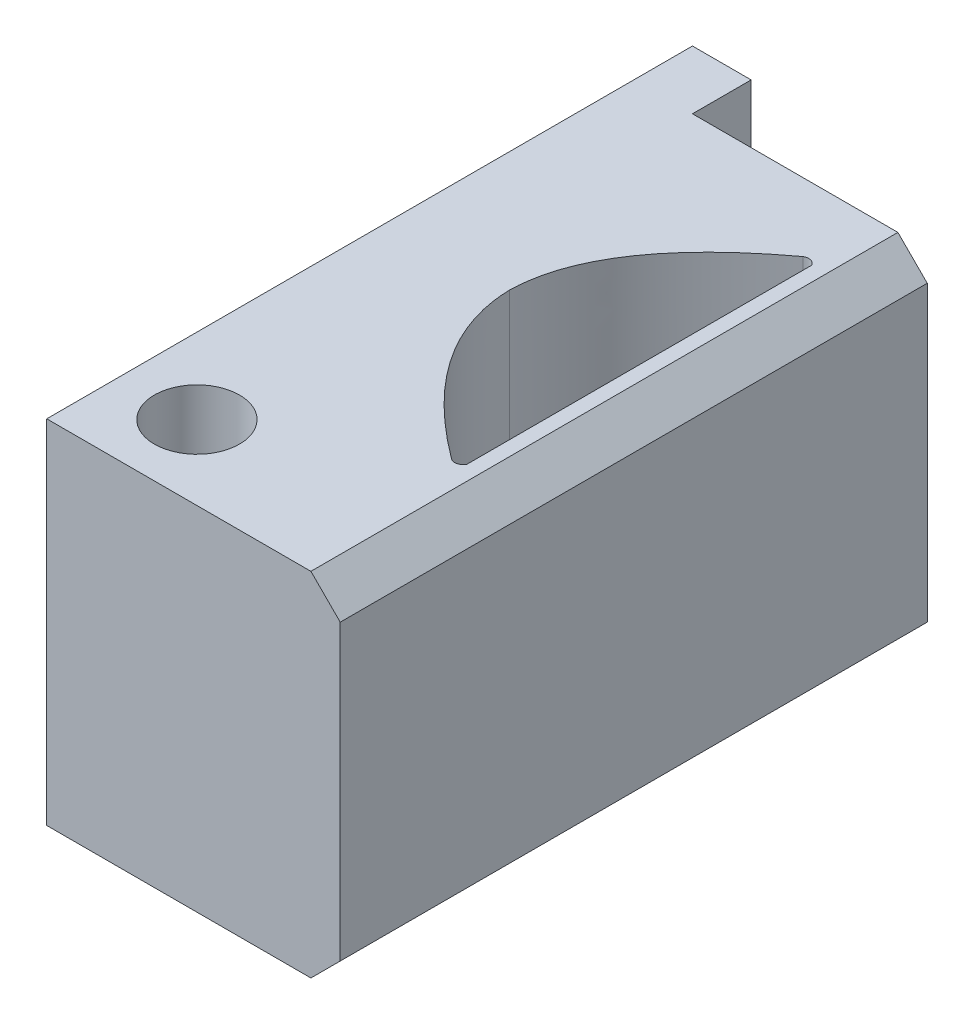
from build123d import *

# Parameters (mm, degrees)
SKETCH2_W           = 10
SKETCH2_H           = 20
BOSS_EXTRUDE1_DEPTH = 12
SKETCH4_R           = 1.45
CUT_EXTRUDE1_DEPTH  = 22
SKETCH5_R           = 0.201375714
CUT_EXTRUDE2_DEPTH  = 34
SKETCH6_R           = 4
CUT_EXTRUDE3_DEPTH  = 2
SKETCH7_W           = 2
SKETCH7_H           = 12
BOSS_EXTRUDE4_DEPTH = 2
CHAMFER1_SIZE       = 1


with BuildPart() as part:
    # Sketch2 → Boss-Extrude1 (new body)
    with BuildSketch(Plane(origin=(0, 0, 0), x_dir=(1, 0, 0), z_dir=(0, 1, 0))):
        with Locations((-9.742268041, 1.958762887)):
            Rectangle(SKETCH2_W, SKETCH2_H)
    extrude(amount=BOSS_EXTRUDE1_DEPTH)

    # Sketch4 → Cut-Extrude1 (cut)
    with BuildSketch(Plane(origin=(0, 12, 0), x_dir=(1, 0, 0), z_dir=(0, 1, 0))):
        with Locations(Location((-12.161364559, -5.505377828, 0), (0, 0, 270))):
            Circle(SKETCH4_R)
    extrude(amount=-CUT_EXTRUDE1_DEPTH, mode=Mode.SUBTRACT)

    # Sketch5 → Cut-Extrude2 (cut)
    # profile 1 of 2: a face of its own
    with BuildSketch(Plane.XZ):
        with BuildLine():
            Line((-6.242268041, -9.519810645), (-6.242268041, 2.231313467))
            ThreePointArc((-6.242268041, 2.231313467), (-6.418660257, 2.371807213), (-6.642496519, 2.344420462))
            add(Edge.make_bspline(
                [(-6.642496519, 2.344420462), (-6.66140925, 2.33038701), (-6.68025518, 2.316351489), (-6.699034308, 2.302313899)],
                knots=[0.023195247, 0.023195247, 0.023195247, 0.023195247, 0.026563492, 0.026563492, 0.026563492, 0.026563492], degree=3))
            add(Edge.make_bspline(
                [(-6.699034308, 2.302313899), (-9.211405567, 0.424290628), (-10.573371912, -1.556580292), (-10.656105812, -3.577082439), (-10.65744251, -3.644248589)],
                knots=[0.026563492, 0.026563492, 0.026563492, 0.026563492, 0.477185204, 0.492669554, 0.492669554, 0.492669554, 0.492669554], degree=3))
            add(Edge.make_bspline(
                [(-6.699034308, -9.590811077), (-9.211405567, -7.712787806), (-10.573371912, -5.731916886), (-10.656105812, -3.711414739), (-10.65744251, -3.644248589)],
                knots=[0.026563492, 0.026563492, 0.026563492, 0.026563492, 0.477185204, 0.492669554, 0.492669554, 0.492669554, 0.492669554], degree=3))
            add(Edge.make_bspline(
                [(-6.642496519, -9.63291764), (-6.66140925, -9.618884188), (-6.68025518, -9.604848667), (-6.699034308, -9.590811077)],
                knots=[0.023195247, 0.023195247, 0.023195247, 0.023195247, 0.026563492, 0.026563492, 0.026563492, 0.026563492], degree=3))
            ThreePointArc((-6.642496519, -9.63291764), (-6.418660257, -9.660304391), (-6.242268041, -9.519810645))
        make_face()
        with Locations((-7.81457768, -3.845615826)):
            Circle(SKETCH5_R, mode=Mode.SUBTRACT)
    # profile 2 of 2: a face of its own
    with BuildSketch(Plane.XZ):
        with Locations((-7.81457768, -3.845615826)):
            Circle(SKETCH5_R)
    extrude(amount=-CUT_EXTRUDE2_DEPTH, mode=Mode.SUBTRACT)

    # Sketch6 → Cut-Extrude3 (cut)
    with BuildSketch(Plane.ZY.offset(14.742268041)):
        with Locations((-6.916385821, 6)):
            Circle(SKETCH6_R)
    extrude(amount=-CUT_EXTRUDE3_DEPTH, mode=Mode.SUBTRACT)

    # Sketch7 → Boss-Extrude4 (add)
    with BuildSketch(Plane(origin=(0, 0, -11.958762887), x_dir=(-1, 0, 0), z_dir=(0, 0, -1))):
        with Locations((13.742268041, 6)):
            Rectangle(SKETCH7_W, SKETCH7_H)
    extrude(amount=BOSS_EXTRUDE4_DEPTH)

    # Chamfer1
    chamfer1_edges = [part.edges().sort_by_distance(p)[0] for p in [
        (-4.742268041, 0, -1.958762887),
        (-4.742268041, 12, -1.958762887),
    ]]
    chamfer(chamfer1_edges, length=CHAMFER1_SIZE)


solid = part.part
